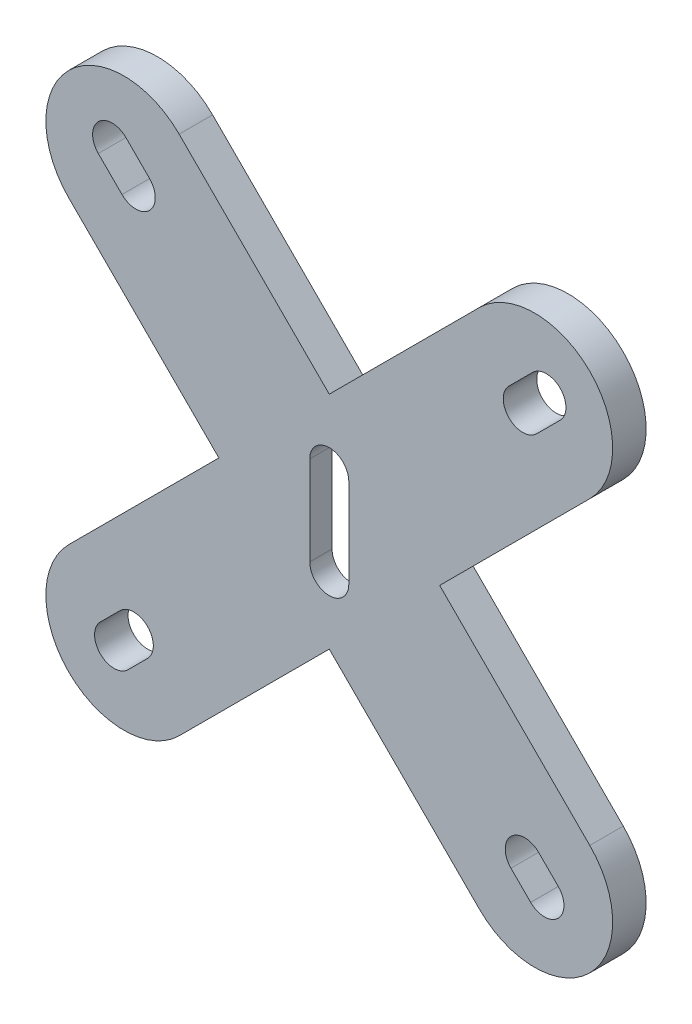
from build123d import *

# Parameters (mm, degrees)
BOSS_EXTRUDE1_DEPTH = 3
CUT_EXTRUDE1_DEPTH  = 10
SKETCH3_OUTSIDE_W   = 98.222
SKETCH3_OUTSIDE_H   = 98.222
CUT_EXTRUDE2_DEPTH  = 10
SKETCH5_R           = 7.5
CUT_EXTRUDE3_DEPTH  = 1
CUT_EXTRUDE4_DEPTH  = 2


with BuildPart() as part:
    # Sketch1 → Boss-Extrude1 (new body)
    with BuildSketch(Plane.XY):
        with BuildLine():
            ThreePointArc((59, 21.5), (35.850628714, 56.145482469), (-5.016504294, 48.016504294))
            Line((-5.016504294, 48.016504294), (48.016504294, -5.016504294))
            ThreePointArc((48.016504294, -5.016504294), (56.145482469, 7.149371286), (59, 21.5))
        make_face()
        with BuildLine():
            Line((48.016504294, -5.016504294), (-5.016504294, 48.016504294))
            ThreePointArc((-5.016504294, 48.016504294), (-5.016504294, -5.016504294), (48.016504294, -5.016504294))
        make_face()
    extrude(amount=BOSS_EXTRUDE1_DEPTH)

    # Sketch2 → Cut-Extrude1 (cut)
    with BuildSketch(Plane(origin=(0, 0, 0), x_dir=(-1, 0, 0), z_dir=(0, 0, -1))):
        with BuildLine():
            Line((-40.089276695, 37.614402961), (-42.210597039, 39.735723305))
            ThreePointArc((-42.210597039, 39.735723305), (-42.210597039, 42.210597039), (-39.735723305, 42.210597039))
            Line((-39.735723305, 42.210597039), (-37.614402961, 40.089276695))
            ThreePointArc((-37.614402961, 40.089276695), (-37.614402961, 37.614402961), (-40.089276695, 37.614402961))
        make_face()
        with BuildLine():
            Line((-5.385597039, 40.089276695), (-3.264276695, 42.210597039))
            ThreePointArc((-3.264276695, 42.210597039), (-0.789402961, 42.210597039), (-0.789402961, 39.735723305))
            Line((-0.789402961, 39.735723305), (-2.910723305, 37.614402961))
            ThreePointArc((-2.910723305, 37.614402961), (-5.385597039, 37.614402961), (-5.385597039, 40.089276695))
        make_face()
        with BuildLine():
            Line((-42.033820344, 3.441053391), (-40.266053391, 5.208820344))
            ThreePointArc((-40.266053391, 5.208820344), (-37.791179656, 5.208820344), (-37.791179656, 2.733946609))
            Line((-37.791179656, 2.733946609), (-39.558946609, 0.966179656))
            ThreePointArc((-39.558946609, 0.966179656), (-42.033820344, 0.966179656), (-42.033820344, 3.441053391))
        make_face()
        with BuildLine():
            Line((-3.441053391, 0.966179656), (-5.208820344, 2.733946609))
            ThreePointArc((-5.208820344, 2.733946609), (-5.208820344, 5.208820344), (-2.733946609, 5.208820344))
            Line((-2.733946609, 5.208820344), (-0.966179656, 3.441053391))
            ThreePointArc((-0.966179656, 3.441053391), (-0.966179656, 0.966179656), (-3.441053391, 0.966179656))
        make_face()
    extrude(amount=-CUT_EXTRUDE1_DEPTH, mode=Mode.SUBTRACT)

    # Sketch3 outside → Cut-Extrude2 (cut)
    with BuildSketch(Plane(origin=(0, 0, 0), x_dir=(-1, 0, 0), z_dir=(0, 0, -1))):
        with Locations((-21.5, 21.5)):
            Rectangle(SKETCH3_OUTSIDE_W, SKETCH3_OUTSIDE_H)
        with BuildLine():
            Line((-34.962752532, 44.862247468), (-21.5, 31.399494937))
            Line((-21.5, 31.399494937), (-8.037247468, 44.862247468))
            ThreePointArc((-8.037247468, 44.862247468), (1.862247468, 44.862247468), (1.862247468, 34.962752532))
            Line((1.862247468, 34.962752532), (-11.600505063, 21.5))
            Line((-11.600505063, 21.5), (1.862247468, 8.037247468))
            ThreePointArc((1.862247468, 8.037247468), (1.862247468, -1.862247468), (-8.037247468, -1.862247468))
            Line((-8.037247468, -1.862247468), (-21.5, 11.600505063))
            Line((-21.5, 11.600505063), (-34.962752532, -1.862247468))
            ThreePointArc((-34.962752532, -1.862247468), (-44.862247468, -1.862247468), (-44.862247468, 8.037247468))
            Line((-44.862247468, 8.037247468), (-31.399494937, 21.5))
            Line((-31.399494937, 21.5), (-44.862247468, 34.962752532))
            ThreePointArc((-44.862247468, 34.962752532), (-44.862247468, 44.862247468), (-34.962752532, 44.862247468))
        make_face(mode=Mode.SUBTRACT)
    extrude(amount=-CUT_EXTRUDE2_DEPTH, mode=Mode.SUBTRACT)

    # Sketch5 → Cut-Extrude3 (cut)
    with BuildSketch(Plane(origin=(0, 0, 0), x_dir=(-1, 0, 0), z_dir=(0, 0, -1))):
        with Locations((-21.5, 21.5)):
            Circle(SKETCH5_R)
    extrude(amount=-CUT_EXTRUDE3_DEPTH, mode=Mode.SUBTRACT)

    # Sketch6 → Cut-Extrude4 (cut)
    with BuildSketch(Plane(origin=(0, 0, 1), x_dir=(-1, 0, 0), z_dir=(0, 0, -1))):
        with BuildLine():
            Line((-23.25, 17.5), (-23.25, 25.5))
            ThreePointArc((-23.25, 25.5), (-21.5, 27.25), (-19.75, 25.5))
            Line((-19.75, 25.5), (-19.75, 17.5))
            ThreePointArc((-19.75, 17.5), (-21.5, 15.75), (-23.25, 17.5))
        make_face()
    extrude(amount=-CUT_EXTRUDE4_DEPTH, mode=Mode.SUBTRACT)


solid = part.part
